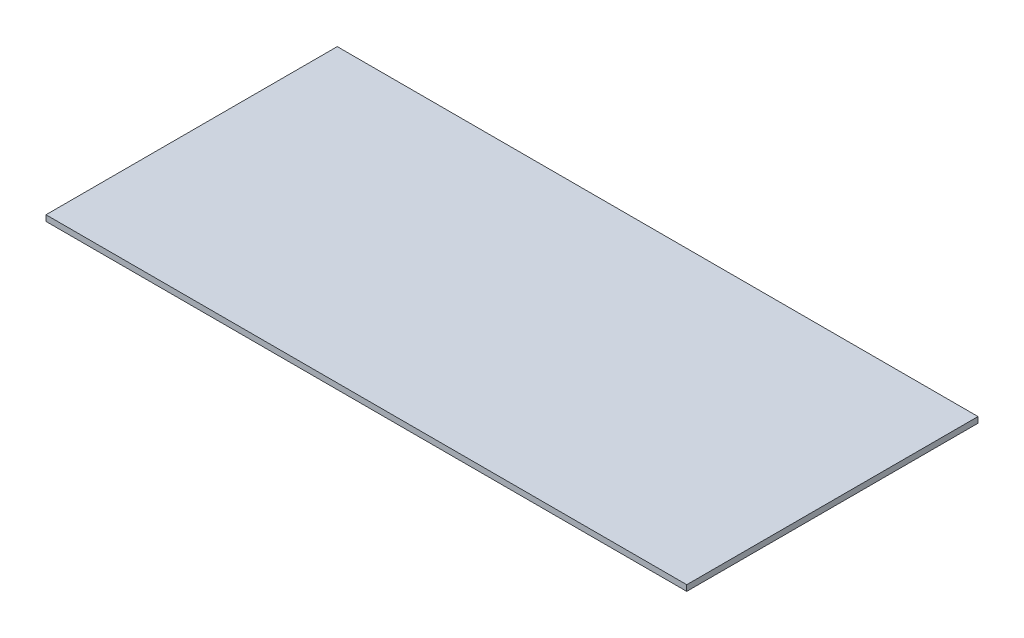
from build123d import *

# Parameters (mm, degrees)
SKETCH1_W           = 330
SKETCH1_H           = 150
BOSS_EXTRUDE1_DEPTH = 3


with BuildPart() as part:
    # Sketch1 → Boss-Extrude1 (new body)
    with BuildSketch(Plane(origin=(0, 0, 0), x_dir=(1, 0, 0), z_dir=(0, 1, 0))):
        with Locations((165, 75)):
            Rectangle(SKETCH1_W, SKETCH1_H)
    extrude(amount=BOSS_EXTRUDE1_DEPTH)


solid = part.part
